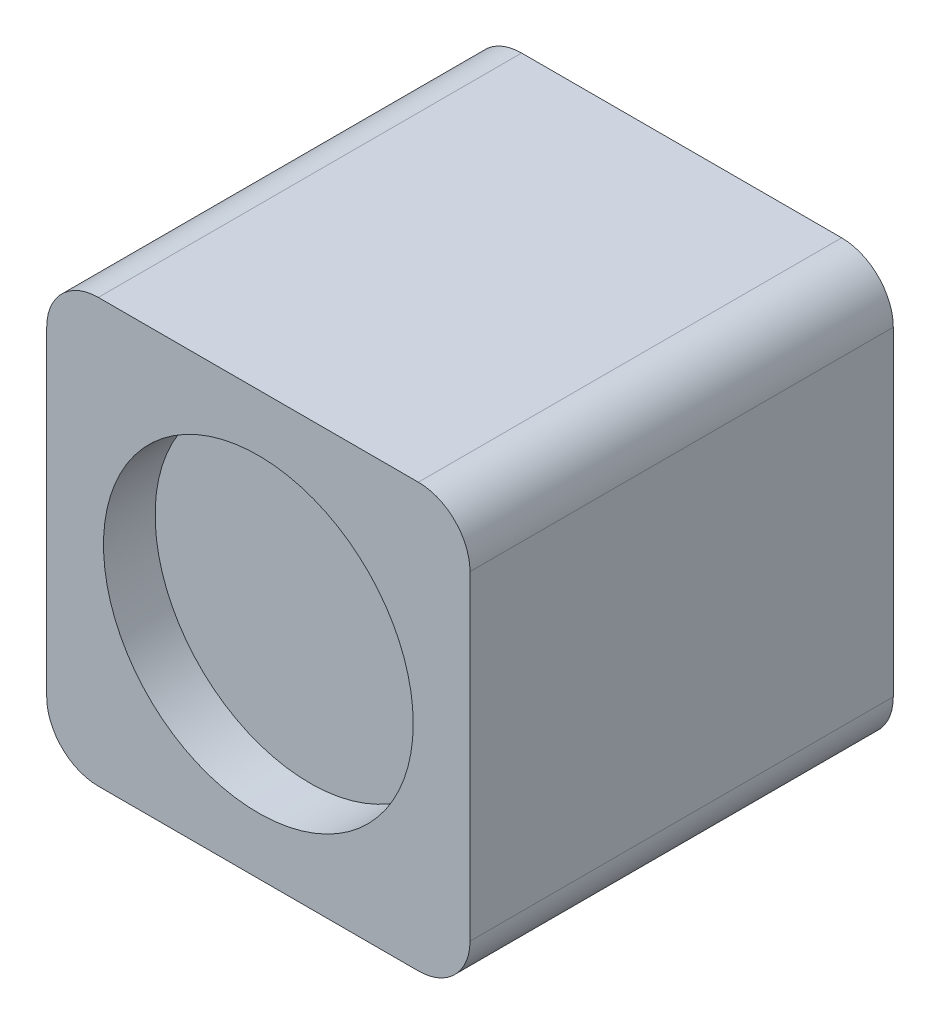
from build123d import *

# Parameters (mm, degrees)
SKETCH_1_W          = 41
SKETCH_1_H          = 41
EXTRUDE_1_DEPTH     = 41
SKETCH_2_R          = 15
CUT_EXTRUDE_1_DEPTH = 5
FILLET_1_R          = 5


with BuildPart() as part:
    # 草图1 → 凸台-拉伸1 (new body)
    with BuildSketch(Plane.XY):
        Rectangle(SKETCH_1_W, SKETCH_1_H)
    extrude(amount=EXTRUDE_1_DEPTH)

    # 草图2 → 切除-拉伸1 (cut)
    with BuildSketch(Plane.XY.offset(41)):
        Circle(SKETCH_2_R)
    extrude(amount=-CUT_EXTRUDE_1_DEPTH, mode=Mode.SUBTRACT)

    # 圆角1
    fillet_1_edges = [part.edges().sort_by_distance(p)[0] for p in [
        (20.5, -20.5, 20.5),
        (-20.5, -20.5, 20.5),
        (-20.5, 20.5, 20.5),
        (20.5, 20.5, 20.5),
    ]]
    fillet(fillet_1_edges, radius=FILLET_1_R)


solid = part.part
